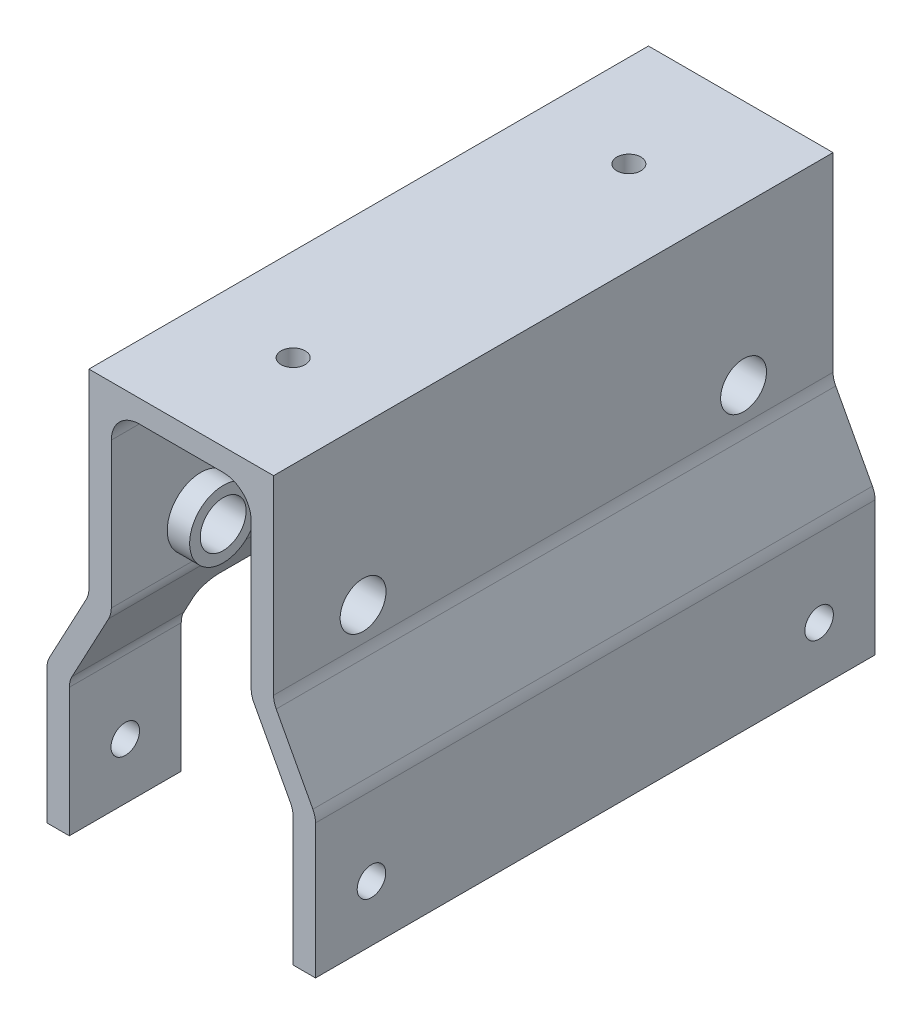
from build123d import *

# Parameters (mm, degrees)
BOSS_EXTRUDE1_DEPTH     = 100
SKETCH3_R               = 6
BOSS_EXTRUDE2_DEPTH     = 4
BOSS_EXTRUDE3_START     = 4
SKETCH4_R               = 6
BOSS_EXTRUDE3_DEPTH     = 4
CUT_EXTRUDE1_DEPTH      = 130.646635128
CUT_EXTRUDE1_DEPTH_BACK = 130.646635128
SKETCH9_R               = 4.1
CUT_EXTRUDE2_DEPTH      = 134.341666406
CUT_EXTRUDE2_DEPTH_BACK = 134.341666406
SKETCH10_R              = 2.55
SKETCH13_W              = 60
SKETCH13_H              = 31.00370213
CUT_EXTRUDE5_DEPTH      = 24
FILLET1_R               = 3
FILLET2_R               = 5
FILLET3_R               = 4
SKETCH15_R              = 2.15
CUT_EXTRUDE6_DEPTH      = 132.954537626


with BuildPart() as part:
    # Sketch2 → Boss-Extrude1 (new body)
    with BuildSketch(Plane.XY):
        Polygon((0, 0), (0, 23.99629787), (7.5, 38), (7.5, 70), (32.5, 70), (32.5, 38), (40, 23.99629787), (40, 0), (44, 0), (44, 25), (36.5, 39.00370213), (36.5, 74), (3.5, 74), (3.5, 39.00370213), (-4, 25), (-4, 0), align=None)
    extrude(amount=BOSS_EXTRUDE1_DEPTH)

    # Sketch3 → Boss-Extrude2 (add)
    with BuildSketch(Plane.ZY.offset(-32.5)):
        with Locations(Location((84, 46, 0), (0, 0, 90))):
            Circle(SKETCH3_R)
        with Locations(Location((16, 46, 0), (0, 0, 90))):
            Circle(SKETCH3_R)
    extrude(amount=BOSS_EXTRUDE2_DEPTH)

    # Sketch4 → Boss-Extrude3 (add)
    with BuildSketch(Plane(origin=(7.5, 0, 0), x_dir=(0, 0, -1), z_dir=(1, 0, 0)).offset(BOSS_EXTRUDE3_START)):
        with Locations(Location((-16, 46, 0), (0, 0, 90))):
            Circle(SKETCH4_R)
        with Locations(Location((-84, 46, 0), (0, 0, 90))):
            Circle(SKETCH4_R)
    extrude(amount=-BOSS_EXTRUDE3_DEPTH)

    # Sketch9 → Cut-Extrude1 (cut, two sides: drawn at the far end of the back side and taken through both)
    with BuildSketch(Plane(origin=(7.5, 0, 0), x_dir=(0, 0, -1), z_dir=(1, 0, 0)).offset(-CUT_EXTRUDE1_DEPTH_BACK)):
        with Locations((-16, 46)):
            Circle(SKETCH9_R)
        with Locations((-84, 46)):
            Circle(SKETCH9_R)
    extrude(amount=CUT_EXTRUDE1_DEPTH + CUT_EXTRUDE1_DEPTH_BACK, mode=Mode.SUBTRACT)

    # Sketch10 → Cut-Extrude2 (cut, two sides: drawn at the far end of the back side and taken through both)
    with BuildSketch(Plane(origin=(44, 0, 0), x_dir=(0, 0, -1), z_dir=(1, 0, 0)).offset(-CUT_EXTRUDE2_DEPTH_BACK)):
        with Locations(Location((-10, 10, 0), (0, 0, 90))):
            Circle(SKETCH10_R)
        with Locations(Location((-90, 10, 0), (0, 0, 90))):
            Circle(SKETCH10_R)
    extrude(amount=CUT_EXTRUDE2_DEPTH + CUT_EXTRUDE2_DEPTH_BACK, mode=Mode.SUBTRACT)

    # Sketch13 → Cut-Extrude5 (cut)
    with BuildSketch(Plane.ZY.offset(4)):
        with Locations((50, 15.501851065)):
            Rectangle(SKETCH13_W, SKETCH13_H)
    extrude(amount=-CUT_EXTRUDE5_DEPTH, mode=Mode.SUBTRACT)

    # Fillet1
    fillet1_edges = [part.edges().sort_by_distance(p)[0] for p in [
        (1.48419643, 31.00370213, 20),
        (1.48419643, 31.00370213, 80),
    ]]
    fillet(fillet1_edges, radius=FILLET1_R)

    # Fillet2
    fillet2_edges = [part.edges().sort_by_distance(p)[0] for p in [
        (32.5, 70, 50),
        (7.5, 70, 50),
    ]]
    fillet(fillet2_edges, radius=FILLET2_R)

    # Fillet3
    fillet3_edges = [part.edges().sort_by_distance(p)[0] for p in [
        (-4, 25, 10),
        (0, 23.99629787, 10),
        (-4, 25, 90),
        (3.5, 39.00370213, 50),
        (36.5, 39.00370213, 50),
        (44, 25, 50),
        (40, 23.99629787, 50),
        (32.5, 38, 50),
        (7.5, 38, 50),
        (0, 23.99629787, 90),
    ]]
    fillet(fillet3_edges, radius=FILLET3_R)

    # Sketch15 → Cut-Extrude6 (cut, through all)
    with BuildSketch(Plane(origin=(0, 74, 0), x_dir=(1, 0, 0), z_dir=(0, 1, 0))):
        with Locations(Location((20, -20, 0), (0, 0, 270))):
            Circle(SKETCH15_R)
        with Locations(Location((20, -80, 0), (0, 0, 270))):
            Circle(SKETCH15_R)
    extrude(amount=-CUT_EXTRUDE6_DEPTH, mode=Mode.SUBTRACT)


solid = part.part
